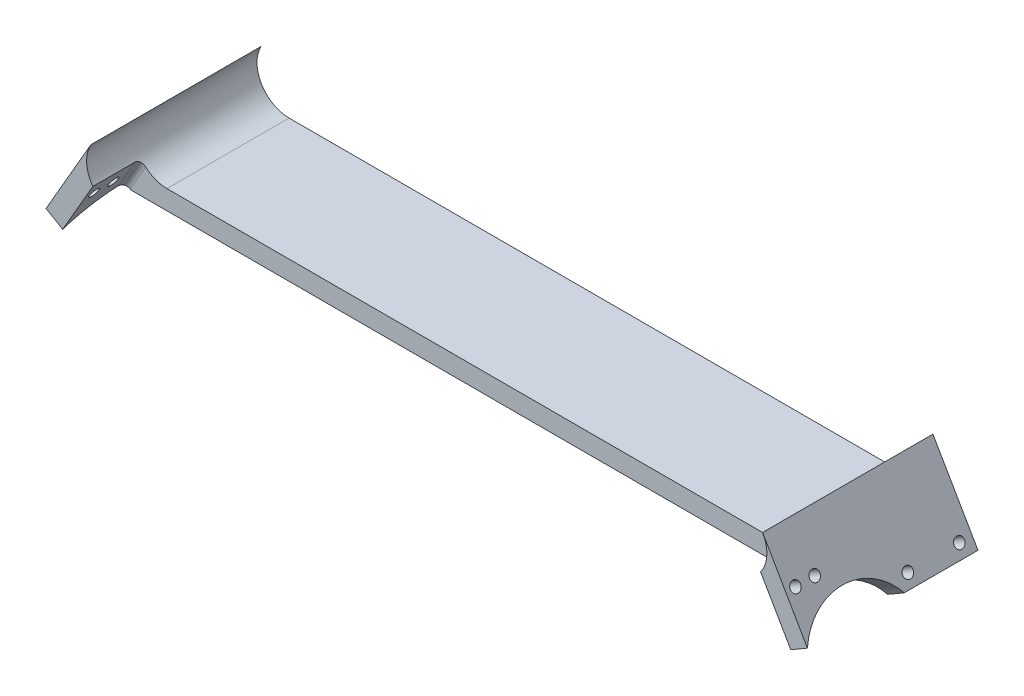
from build123d import *

# Parameters (mm, degrees)
BOSS_EXTRUDE1_DEPTH = 2
BOSS_EXTRUDE2_DEPTH = 38
MANUAL_FILLET_DEPTH = 38
SKETCH7_R           = 1.399999999999996
SKETCH7_R_2         = 1.4
SKETCH7_R_3         = 1.3999999999999992
SKETCH7_R_4         = 1.4000000000000026
BOTTOM_SCREWS_DEPTH = 9
LEFT_SCREWS_REACH   = 212.024
SKETCH8_R           = 1.6000000000000127
SKETCH8_R_2         = 1.600000000000008
RIGHT_SCREWS_REACH  = 212.024
SKETCH9_R           = 1.6000000000000127
SKETCH9_R_2         = 1.600000000000007
BOSS_EXTRUDE3_DEPTH = 15
CUT_EXTRUDE1_REACH  = 220.907
SKETCH10_R          = 17.50000000000029
SKETCH10_R_2        = 1.6000000000000194
SKETCH10_R_3        = 1.5999999999999908
CUT_EXTRUDE2_REACH  = 220.907
SKETCH11_R          = 17.500000000000004
SKETCH11_R_2        = 1.600000000000006
SKETCH11_R_3        = 1.5999999999999974
FILLET1_R           = 2


with BuildPart() as part:
    # Sketch2 → Boss-Extrude1 (new body)
    with BuildSketch(Plane.XY):
        Polygon((-113.14018169510446, 0), (113.14018169510446, 2.771e-14), (118.50513169510454, -9.292365980066561), (113.30897927239795, -12.292365980066618), (109.67608007996674, -5.999999999999973), (-109.67608007996674, -6), (-113.30897927239795, -12.292365980066647), (-118.50513169510454, -9.292365980066593), align=None)
    extrude(amount=BOSS_EXTRUDE1_DEPTH)

    # Sketch2<3> → Boss-Extrude2 (add)
    with BuildSketch(Plane.XY):
        Polygon((-113.14018169510446, 0), (113.14018169510446, 2.771e-14), (118.50513169510454, -9.292365980066561), (113.30897927239795, -12.292365980066618), (109.67608007996674, -5.999999999999973), (-109.67608007996674, -6), (-113.30897927239795, -12.292365980066647), (-118.50513169510454, -9.292365980066593), align=None)
    extrude(amount=BOSS_EXTRUDE2_DEPTH)

    # Sketch6 → Manual fillet (add)
    with BuildSketch(Plane(origin=(0, 0, 0), x_dir=(-1, 0, 0), z_dir=(0, 0, -1))):
        with BuildLine():
            Line((-114.87223250267334, -2.99999999999992), (-104.47992765725986, 15.00000000000004))
            ThreePointArc((-104.47992765725986, 15.00000000000004), (-104.47992765725994, 5.00000000000003), (-95.81967361941555, -2.602e-14))
            Line((-95.81967361941555, -2.602e-14), (95.81967361941547, -1.73e-15))
            ThreePointArc((95.81967361941547, -1.73e-15), (104.47992765725988, 5.00000000000004), (104.47992765725981, 15.000000000000083))
            Line((104.47992765725981, 15.000000000000083), (114.87223250267334, -2.999999999999949))
            Line((114.87223250267334, -2.999999999999949), (109.67608007996674, -6))
            Line((109.67608007996674, -6), (-109.67608007996674, -5.999999999999973))
            Line((-109.67608007996674, -5.999999999999973), (-114.87223250267334, -2.99999999999992))
        make_face()
    extrude(amount=-MANUAL_FILLET_DEPTH)

    # Sketch7 → Bottom screws (cut)
    with BuildSketch(Plane.XY):
        with Locations((57.436116251336735, -3.0000000000000004)):
            Circle(SKETCH7_R)
        with Locations((-1.25e-15, -3.0000000000000004)):
            Circle(SKETCH7_R_2)
        with Locations((-57.436116251336564, -3.0000000000000004)):
            Circle(SKETCH7_R)
        with Locations((-28.718058125668286, -3.000000000000001)):
            Circle(SKETCH7_R_3)
        with Locations((28.718058125668367, -3.000000000000001)):
            Circle(SKETCH7_R_3)
        with Locations((-86.15417437700485, -3.000000000000001)):
            Circle(SKETCH7_R_4)
        with Locations((86.15417437700509, -3.000000000000001)):
            Circle(SKETCH7_R_4)
    extrude(amount=BOTTOM_SCREWS_DEPTH, mode=Mode.SUBTRACT)

    # Sketch8 → Left screws (cut, up to next)
    with BuildSketch(Plane(origin=(-79.65898384862079, 45.991135768374306, 0), x_dir=(0, 0, -1), z_dir=(0.8660254037844329, -0.5000000000000101, 0)), mode=Mode.PRIVATE) as left_screws_sk1:
        with Locations(Location((-20, -63.66709165512205, 0), (0, 0, 90))):
            Circle(SKETCH8_R)
    left_screws_tool1 = extrude(left_screws_sk1.sketch, amount=-LEFT_SCREWS_REACH, mode=Mode.PRIVATE) & part.part
    # Sketch8 → Left screws (cut, up to next)
    with BuildSketch(Plane(origin=(-79.65898384862079, 45.991135768374306, 0), x_dir=(0, 0, -1), z_dir=(0.8660254037844329, -0.5000000000000101, 0)), mode=Mode.PRIVATE) as left_screws_sk2:
        with Locations(Location((-4, -63.66709165512205, 0), (0, 0, 90))):
            Circle(SKETCH8_R_2)
    left_screws_tool2 = extrude(left_screws_sk2.sketch, amount=-LEFT_SCREWS_REACH, mode=Mode.PRIVATE) & part.part
    add(left_screws_tool1.solids().sort_by_distance((-111.49253, -9.146183, 20))[0], mode=Mode.SUBTRACT)
    add(left_screws_tool2.solids().sort_by_distance((-111.49253, -9.146183, 4))[0], mode=Mode.SUBTRACT)

    # Sketch9 → Right screws (cut, up to next)
    with BuildSketch(Plane(origin=(79.6589838486208, 45.99113576837435, 0), x_dir=(0, 0, 1), z_dir=(-0.8660254037844329, -0.5000000000000101, 0)), mode=Mode.PRIVATE) as right_screws_sk1:
        with Locations(Location((20, -63.66709165512205, 0), (0, 0, 270))):
            Circle(SKETCH9_R)
    right_screws_tool1 = extrude(right_screws_sk1.sketch, amount=-RIGHT_SCREWS_REACH, mode=Mode.PRIVATE) & part.part
    # Sketch9 → Right screws (cut, up to next)
    with BuildSketch(Plane(origin=(79.6589838486208, 45.99113576837435, 0), x_dir=(0, 0, 1), z_dir=(-0.8660254037844329, -0.5000000000000101, 0)), mode=Mode.PRIVATE) as right_screws_sk2:
        with Locations(Location((4, -63.66709165512205, 0), (0, 0, 270))):
            Circle(SKETCH9_R_2)
    right_screws_tool2 = extrude(right_screws_sk2.sketch, amount=-RIGHT_SCREWS_REACH, mode=Mode.PRIVATE) & part.part
    add(right_screws_tool1.solids().sort_by_distance((111.49253, -9.146183, 20))[0], mode=Mode.SUBTRACT)
    add(right_screws_tool2.solids().sort_by_distance((111.49253, -9.146183, 4))[0], mode=Mode.SUBTRACT)

    # Sketch12 → Boss-Extrude3 (add)
    with BuildSketch(Plane.XY.offset(38.000000000000064)):
        with BuildLine():
            Line((103.86635092950917, 4.062746066806283), (113.30897927239795, -12.292365980066622))
            Line((113.30897927239795, -12.292365980066622), (118.50513169510454, -9.292365980066565))
            Line((118.50513169510454, -9.292365980066565), (104.47992765725988, 15.00000000000004))
            ThreePointArc((104.47992765725988, 15.00000000000004), (105.80397478003607, 9.439883642417866), (103.86635092950917, 4.062746066806283))
        make_face()
        with BuildLine():
            Line((-104.47992765725981, 15.000000000000082), (-118.50513169510454, -9.292365980066597))
            Line((-118.50513169510454, -9.292365980066597), (-113.30897927239795, -12.29236598006665))
            Line((-113.30897927239795, -12.29236598006665), (-103.86635092950914, 4.062746066806313))
            ThreePointArc((-103.86635092950914, 4.062746066806313), (-105.80397478003603, 9.439883642417914), (-104.47992765725981, 15.000000000000082))
        make_face()
    extrude(amount=BOSS_EXTRUDE3_DEPTH)

    # Sketch10 → Cut-Extrude1 (cut, up to next)
    with BuildSketch(Plane(origin=(84.85513627132735, 48.991135768374356, 0), x_dir=(0, 0, -1), z_dir=(0.8660254037844342, 0.500000000000008, 0)), mode=Mode.PRIVATE) as cut_extrude1_sk1:
        with Locations((-38.000000000000085, -76.19999084755334)):
            Circle(SKETCH10_R)
    cut_extrude1_tool1 = extrude(cut_extrude1_sk1.sketch, amount=-CUT_EXTRUDE1_REACH, mode=Mode.PRIVATE) & part.part
    # Sketch10 → Cut-Extrude1 (cut, up to next)
    with BuildSketch(Plane(origin=(84.85513627132735, 48.991135768374356, 0), x_dir=(0, 0, -1), z_dir=(0.8660254037844342, 0.500000000000008, 0)), mode=Mode.PRIVATE) as cut_extrude1_sk2:
        with Locations(Location((-43.99999999999998, -53.69999084755312, 0), (0, 0, 90))):
            Circle(SKETCH10_R_2)
    cut_extrude1_tool2 = extrude(cut_extrude1_sk2.sketch, amount=-CUT_EXTRUDE1_REACH, mode=Mode.PRIVATE) & part.part
    # Sketch10 → Cut-Extrude1 (cut, up to next)
    with BuildSketch(Plane(origin=(84.85513627132735, 48.991135768374356, 0), x_dir=(0, 0, -1), z_dir=(0.8660254037844342, 0.500000000000008, 0)), mode=Mode.PRIVATE) as cut_extrude1_sk3:
        with Locations(Location((-49.99999999999997, -53.69999084755311, 0), (0, 0, 90))):
            Circle(SKETCH10_R_3)
    cut_extrude1_tool3 = extrude(cut_extrude1_sk3.sketch, amount=-CUT_EXTRUDE1_REACH, mode=Mode.PRIVATE) & part.part
    add(cut_extrude1_tool1.solids().sort_by_distance((122.955132, -16.999992, 38))[0], mode=Mode.SUBTRACT)
    add(cut_extrude1_tool2.solids().sort_by_distance((111.705132, 2.48558, 44))[0], mode=Mode.SUBTRACT)
    add(cut_extrude1_tool3.solids().sort_by_distance((111.705132, 2.48558, 50))[0], mode=Mode.SUBTRACT)

    # Sketch11 → Cut-Extrude2 (cut, up to next)
    with BuildSketch(Plane(origin=(-84.85513627132738, 48.99113576837434, 0), x_dir=(0, 0, 1), z_dir=(-0.8660254037844335, 0.500000000000009, 0)), mode=Mode.PRIVATE) as cut_extrude2_sk1:
        with Locations((38.000000000000085, -76.19999084755318)):
            Circle(SKETCH11_R)
    cut_extrude2_tool1 = extrude(cut_extrude2_sk1.sketch, amount=-CUT_EXTRUDE2_REACH, mode=Mode.PRIVATE) & part.part
    # Sketch11 → Cut-Extrude2 (cut, up to next)
    with BuildSketch(Plane(origin=(-84.85513627132738, 48.99113576837434, 0), x_dir=(0, 0, 1), z_dir=(-0.8660254037844335, 0.500000000000009, 0)), mode=Mode.PRIVATE) as cut_extrude2_sk2:
        with Locations(Location((50.00000000000008, -53.699990847553025, 0), (0, 0, 270))):
            Circle(SKETCH11_R_2)
    cut_extrude2_tool2 = extrude(cut_extrude2_sk2.sketch, amount=-CUT_EXTRUDE2_REACH, mode=Mode.PRIVATE) & part.part
    # Sketch11 → Cut-Extrude2 (cut, up to next)
    with BuildSketch(Plane(origin=(-84.85513627132738, 48.99113576837434, 0), x_dir=(0, 0, 1), z_dir=(-0.8660254037844335, 0.500000000000009, 0)), mode=Mode.PRIVATE) as cut_extrude2_sk3:
        with Locations(Location((44.00000000000008, -53.699990847553025, 0), (0, 0, 270))):
            Circle(SKETCH11_R_3)
    cut_extrude2_tool3 = extrude(cut_extrude2_sk3.sketch, amount=-CUT_EXTRUDE2_REACH, mode=Mode.PRIVATE) & part.part
    add(cut_extrude2_tool1.solids().sort_by_distance((-122.955132, -16.999992, 38))[0], mode=Mode.SUBTRACT)
    add(cut_extrude2_tool2.solids().sort_by_distance((-111.705132, 2.48558, 50))[0], mode=Mode.SUBTRACT)
    add(cut_extrude2_tool3.solids().sort_by_distance((-111.705132, 2.48558, 44))[0], mode=Mode.SUBTRACT)

    # Fillet1
    fillet1_edges = [part.edges().sort_by_distance(p)[0] for p in [
        (106.4376651009535, -0.3909007203570517, 38.000000000000064),
        (-106.43766510095352, -0.3909007203571352, 38.000000000000064),
    ]]
    fillet(fillet1_edges, radius=FILLET1_R)


solid = part.part
